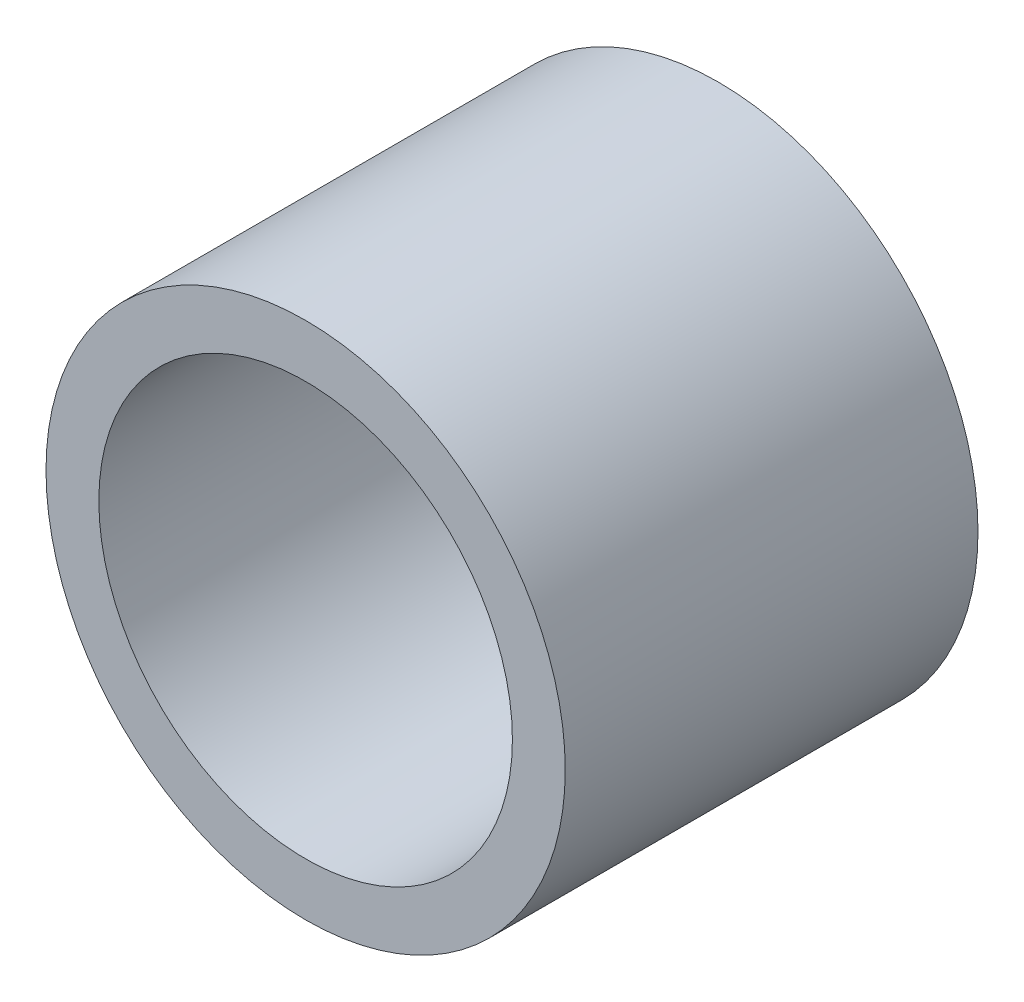
from build123d import *

# Parameters (mm, degrees)
BOSS_EXTRUDE1_DEPTH      = 3.175
BOSS_EXTRUDE1_DEPTH_BACK = 3.175
SKETCH5_R                = 3.99415
SKETCH5_R_2              = 3.18135


with BuildPart() as part:
    # Sketch5 → Boss-Extrude1 (new, two sides: drawn at the far end of the back side and taken through both)
    with BuildSketch(Plane.XY.offset(-BOSS_EXTRUDE1_DEPTH_BACK)):
        Circle(SKETCH5_R)
        Circle(SKETCH5_R_2, mode=Mode.SUBTRACT)
    extrude(amount=BOSS_EXTRUDE1_DEPTH + BOSS_EXTRUDE1_DEPTH_BACK)


solid = part.part
